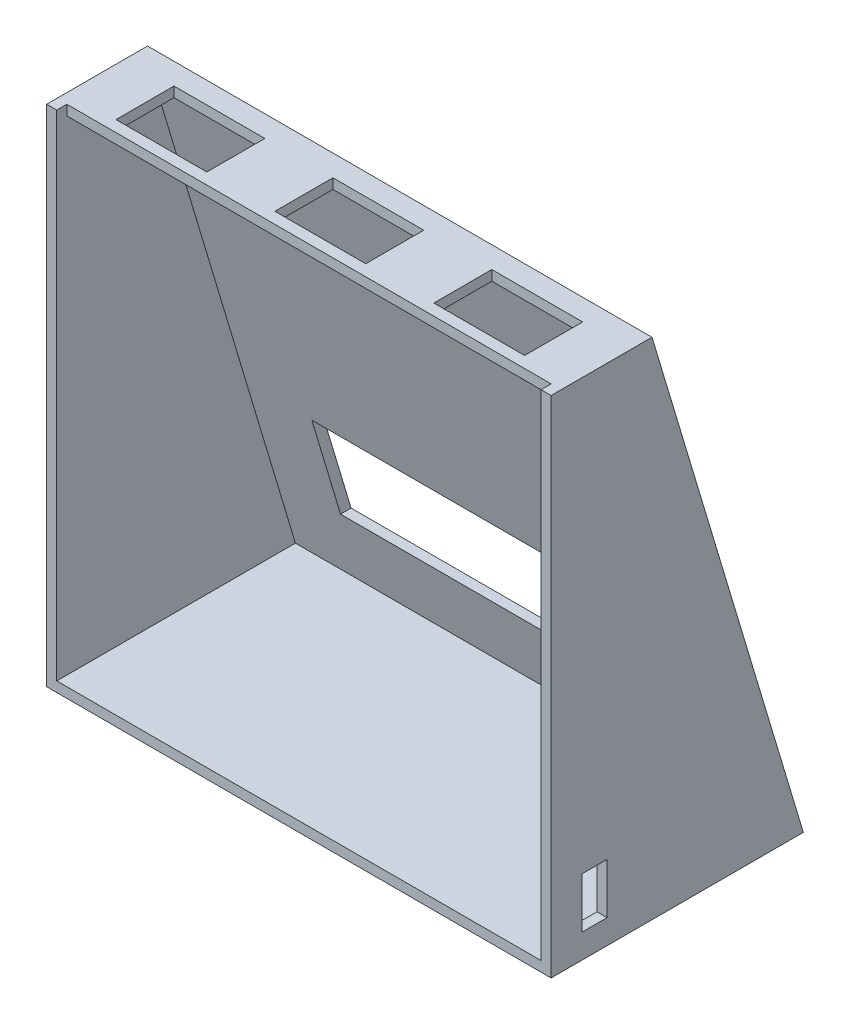
from build123d import *

# Parameters (mm, degrees)
BOSS_EXTRUDE1_DEPTH     = 2
BOSS_EXTRUDE2_DEPTH     = 96
BOSS_EXTRUDE3_DEPTH     = 2
CUT_EXTRUDE1_DEPTH      = 2
CUT_EXTRUDE2_DEPTH      = 20
CUT_EXTRUDE2_DEPTH_BACK = 2
SKETCH6_W               = 5
SKETCH6_H               = 10
CUT_EXTRUDE3_DEPTH      = 2


with BuildPart() as part:
    # Sketch1 → Boss-Extrude1 (new body)
    with BuildSketch(Plane(origin=(0, 0, 0), x_dir=(0, 0, -1), z_dir=(1, 0, 0))):
        Polygon((-46.565590075, -45.805369128), (3.434409925, -45.805369128), (-26.565590075, 54.194630872), (-46.565590075, 54.194630872), align=None)
    extrude(amount=BOSS_EXTRUDE1_DEPTH)

    # Sketch2 → Boss-Extrude2 (add)
    with BuildSketch(Plane(origin=(2, 0, 0), x_dir=(0, 0, -1), z_dir=(1, 0, 0))):
        Polygon((-26.565590075, 54.194630872), (3.434409925, -45.805369128), (-44.565590075, -45.805369128), (-46.565590075, -45.805369128), (-46.565590075, -43.805369128), (-44.565590075, -43.805369128), (0.746348624, -43.805369128), (-28.053651376, 52.194630872), (-44.565590075, 52.194630872), (-44.565590075, 54.194630872), align=None)
    extrude(amount=BOSS_EXTRUDE2_DEPTH)

    # Sketch3 → Boss-Extrude3 (add)
    with BuildSketch(Plane(origin=(98, 0, 0), x_dir=(0, 0, -1), z_dir=(1, 0, 0))):
        Polygon((-46.565590075, 54.194630872), (-26.565590075, 54.194630872), (3.434409925, -45.805369128), (-46.565590075, -45.805369128), align=None)
    extrude(amount=BOSS_EXTRUDE3_DEPTH)

    # Sketch4 → Cut-Extrude1 (cut)
    with BuildSketch(Plane(origin=(0, 54.194630872, 0), x_dir=(1, 0, 0), z_dir=(0, 1, 0))):
        Polygon((50, -30.815590075), (59, -30.815590075), (59, -36.565590075), (59, -42.315590075), (41, -42.315590075), (41, -30.815590075), align=None)
        Polygon((72.5, -30.815590075), (72.5, -42.315590075), (90.5, -42.315590075), (90.5, -36.565590075), (90.5, -30.815590075), align=None)
        Polygon((27.5, -30.815590075), (27.5, -42.315590075), (9.5, -42.315590075), (9.5, -36.565590075), (9.5, -30.815590075), align=None)
    extrude(amount=-CUT_EXTRUDE1_DEPTH, mode=Mode.SUBTRACT)

    # Sketch5 → Cut-Extrude2 (cut, two sides: drawn at the far end of the back side and taken through both)
    with BuildSketch(Plane.XY.offset(-CUT_EXTRUDE2_DEPTH_BACK)):
        Polygon((85, -11.305369128), (50, -11.305369128), (15, -11.305369128), (15, -20.805369128), (15, -30.305369128), (85, -30.305369128), align=None)
    extrude(amount=CUT_EXTRUDE2_DEPTH + CUT_EXTRUDE2_DEPTH_BACK, mode=Mode.SUBTRACT)

    # Sketch6 → Cut-Extrude3 (cut)
    with BuildSketch(Plane(origin=(100, 0, 0), x_dir=(0, 0, -1), z_dir=(1, 0, 0))):
        with Locations((-37.982930648, -35.987256773)):
            Rectangle(SKETCH6_W, SKETCH6_H)
    extrude(amount=-CUT_EXTRUDE3_DEPTH, mode=Mode.SUBTRACT)


solid = part.part
